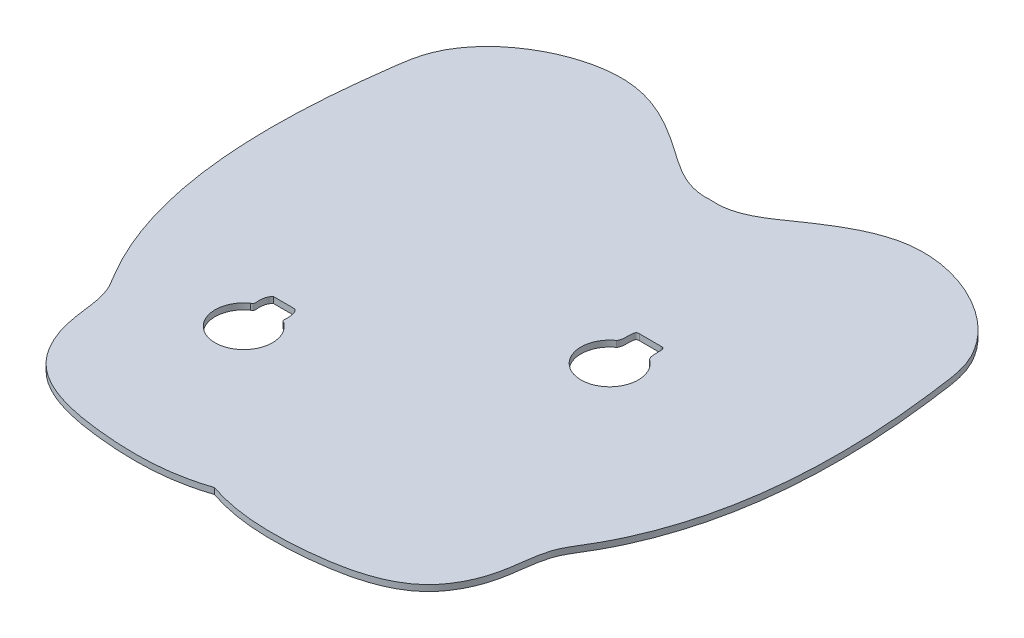
from build123d import *

# Parameters (mm, degrees)
BOSS_EXTRUDE1_DEPTH = 2.54


with BuildPart() as part:
    # Sketch1 → Boss-Extrude1 (new body)
    with BuildSketch(Plane(origin=(0, 0, 0), x_dir=(1, 0, 0), z_dir=(0, 1, 0))):
        with BuildLine():
            add(Edge.make_bspline(
                [(97.172135124, -18.415391272), (107.406134364, -19.286906728), (124.882327, -6.070352296), (162.388558115, 17.269805069), (208.58252399, -8.22535922), (212.354612626, -36.879397702), (218.552942284, -85.518563944), (216.586330518, -137.434896367), (188.947028507, -180.268479022), (189.164176864, -197.344803998), (176.934378203, -224.155676751), (138.598984513, -232.253076747), (110.98510957, -231.368122157), (97.172135124, -226.672036014)],
                knots=[0, 0, 0, 0, 0.068768703, 0.16025839, 0.311610256, 0.345034354, 0.37053541, 0.674249376, 0.690214482, 0.741590818, 0.795466329, 0.892793029, 1, 1, 1, 1], degree=3))
            add(Edge.make_bspline(
                [(97.172135124, -18.415391272), (86.938135885, -19.286906728), (69.461943248, -6.070352296), (31.955712133, 17.269805069), (-14.238253742, -8.22535922), (-18.010342378, -36.879397702), (-24.208672036, -85.518563944), (-22.24206027, -137.434896367), (5.397241741, -180.268479022), (5.180093384, -197.344803998), (17.409892046, -224.155676751), (55.745285735, -232.253076747), (83.359160679, -231.368122157), (97.172135124, -226.672036014)],
                knots=[0, 0, 0, 0, 0.068768703, 0.16025839, 0.311610256, 0.345034354, 0.37053541, 0.674249376, 0.690214482, 0.741590818, 0.795466329, 0.892793029, 1, 1, 1, 1], degree=3))
        make_face()
        with BuildLine():
            Line((139.526871586, -81.868161302), (135.099715556, -81.868161302))
            Line((135.099715556, -81.868161302), (134.898741205, -81.868161302))
            Line((134.898741205, -81.868161302), (130.471585174, -81.868161302))
            add(Edge.make_bspline(
                [(128.013930771, -89.110824713), (128.871790734, -88.162008062), (128.877525775, -86.168664391), (128.906248151, -83.511735671), (129.192079186, -81.706057522), (130.471585174, -81.868161302)],
                knots=[0, 0, 0, 0, 0.420984211, 0.69167111, 1, 1, 1, 1], degree=3))
            ThreePointArc((128.013930771, -89.110824713), (134.99922838, -110.868161302), (141.984525989, -89.110824713))
            add(Edge.make_bspline(
                [(141.984525989, -89.110824713), (141.126666026, -88.162008062), (141.120930985, -86.168664391), (141.092208609, -83.511735671), (140.806377574, -81.706057522), (139.526871586, -81.868161302)],
                knots=[0, 0, 0, 0, 0.420984211, 0.69167111, 1, 1, 1, 1], degree=3))
        make_face(mode=Mode.SUBTRACT)
        with BuildLine():
            Line((40.340114274, -145.018397049), (44.767270304, -145.018397049))
            Line((44.767270304, -145.018397049), (44.968244655, -145.018397049))
            Line((44.968244655, -145.018397049), (49.395400686, -145.018397049))
            add(Edge.make_bspline(
                [(51.853055088, -152.26106046), (50.720398562, -152.139704427), (51.085264768, -150.268136991), (50.968349677, -147.697970296), (50.354074276, -145.772707702), (49.395400686, -145.018397049)],
                knots=[0, 0, 0, 0, 0.29914721, 0.575401743, 1, 1, 1, 1], degree=3))
            ThreePointArc((51.853055088, -152.26106046), (44.86775748, -174.018397049), (37.882459871, -152.26106046))
            add(Edge.make_bspline(
                [(37.882459871, -152.26106046), (39.015116397, -152.139704427), (38.650250191, -150.268136991), (38.767165282, -147.697970296), (39.381440683, -145.772707702), (40.340114274, -145.018397049)],
                knots=[0, 0, 0, 0, 0.29914721, 0.575401743, 1, 1, 1, 1], degree=3))
        make_face(mode=Mode.SUBTRACT)
    extrude(amount=BOSS_EXTRUDE1_DEPTH)


solid = part.part
